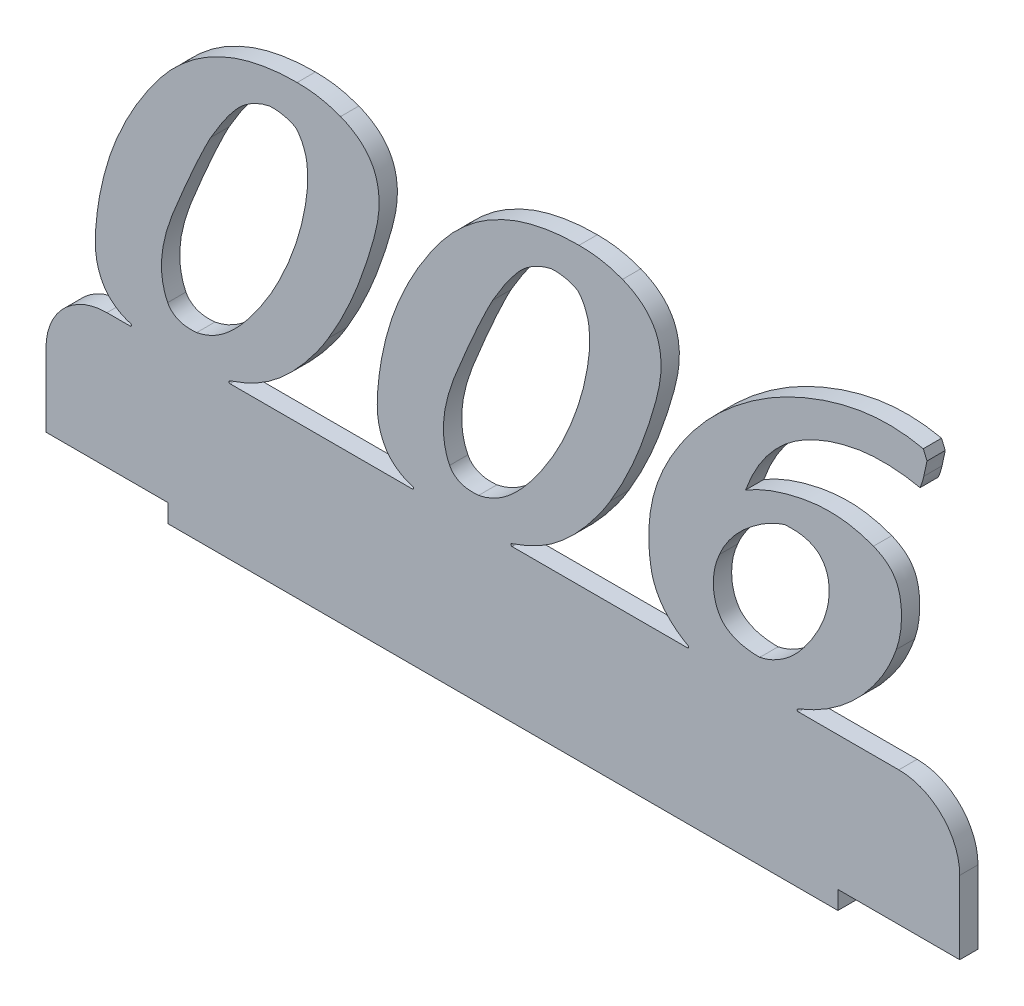
from build123d import *

# Parameters (mm, degrees)
BOSS_EXTRUDE1_DEPTH = 3
FILLET1_R           = 10
FILLET2_R           = 0.2


with BuildPart() as part:
    # Sketch1 → Boss-Extrude1 (new body)
    with BuildSketch(Plane.XY):
        with BuildLine():
            Line((122.4075168, 22.000000006), (150, 22.000001605))
            Line((150, 22.000001605), (150, 0))
            Line((150, 0), (130, 0))
            Line((130, 0), (130, -3))
            Line((130, -3), (20, -3))
            Line((20, -3), (20, 0))
            Line((20, 0), (0, 0))
            Line((0, 0), (0, 21.999999988))
            Line((0, 21.999999988), (15.311365218, 21.999999988))
            add(Edge.make_bspline(
                [(15.311365218, 21.999999988), (14.849794417, 22.113433586), (13.865602704, 22.384922298), (12.415535541, 22.895658378), (11.109150194, 23.745516599), (9.999187198, 24.764577141), (9.169313791, 26.041847988), (8.563831538, 27.513378189), (8.010207131, 29.878220371), (8.079839361, 31.797926946), (8.170181628, 33.112460211)],
                knots=[0.4482427, 0.4482427, 0.4482427, 0.4482427, 0.501387928, 0.562299825, 0.61931963, 0.674487907, 0.729675441, 0.788153341, 0.851799168, 1, 1, 1, 1], degree=3))
            add(Edge.make_bspline(
                [(8.170181628, 33.112460211), (8.337105694, 35.340556619), (8.826298564, 38.666130245), (9.955685037, 43.002934363), (11.018517432, 46.212297745), (12.373140875, 49.345635262), (13.911139099, 52.451464487), (15.718875628, 55.494613428), (17.725960704, 58.461747451), (19.923499141, 61.251096147), (22.397753947, 63.669909948), (25.04001838, 65.757541635), (27.920238635, 67.404932429), (30.955738631, 68.752774119), (35.378146308, 69.975102855), (38.856865163, 70.359817134), (41.223348165, 70.329035661)],
                knots=[0, 0, 0, 0, 0.122246067, 0.183381441, 0.245050885, 0.307031795, 0.37001055, 0.434578783, 0.500534692, 0.565957523, 0.628479512, 0.689453544, 0.749684058, 0.80955899, 0.870724503, 1, 1, 1, 1], degree=3))
            add(Edge.make_bspline(
                [(41.223348165, 70.329035661), (42.48358762, 70.318585807), (44.926426901, 70.175069876), (47.266580825, 69.465214081), (48.357828227, 69.058511814)],
                knots=[0, 0, 0, 0, 0.519885394, 1, 1, 1, 1], degree=3))
            add(Edge.make_bspline(
                [(48.357828227, 69.058511814), (49.625375641, 68.543213602), (51.420428299, 67.54986363), (53.159740965, 65.566951611), (54.069263058, 63.893477491), (54.584545639, 61.988558677), (54.749856614, 59.871513315), (54.556749177, 57.540744771), (53.807348911, 54.201337228), (52.528828565, 50.034909143), (50.227644954, 43.731329629), (48.030728771, 39.305052238), (46.364083114, 36.552647858)],
                knots=[0, 0, 0, 0, 0.111905612, 0.162582178, 0.212592743, 0.265416324, 0.321765959, 0.384451445, 0.45478123, 0.599580751, 0.738515281, 1, 1, 1, 1], degree=3))
            add(Edge.make_bspline(
                [(46.364083114, 36.552647858), (45.272598995, 34.695435575), (43.402301562, 32.124961088), (40.652950183, 29.001977978), (38.484255286, 26.932710145), (36.101823608, 25.125047689), (33.422099812, 23.629253577), (30.988119124, 22.639819784), (29.448304613, 22.152860605), (28.920236873, 21.999999988)],
                knots=[0, 0, 0, 0, 0.257859597, 0.380113614, 0.498337489, 0.61657684, 0.737567111, 0.865047578, 0.930898872, 0.930898872, 0.930898872, 0.930898872], degree=3))
            Line((28.920236873, 21.999999988), (61.5975263, 21.999999988))
            add(Edge.make_bspline(
                [(61.5975263, 21.999999988), (61.135955493, 22.113433587), (60.151763773, 22.384922294), (58.701696604, 22.895658379), (57.395311257, 23.745516598), (56.285348261, 24.764577141), (55.455474854, 26.041847988), (54.849992601, 27.513378189), (54.296368194, 29.878220371), (54.366000425, 31.797926946), (54.456342692, 33.112460211)],
                knots=[0.4482427, 0.4482427, 0.4482427, 0.4482427, 0.501387928, 0.562299825, 0.61931963, 0.674487907, 0.729675441, 0.788153341, 0.851799168, 1, 1, 1, 1], degree=3))
            add(Edge.make_bspline(
                [(54.456342692, 33.112460211), (54.623266758, 35.340556619), (55.112459628, 38.666130245), (56.241846101, 43.002934363), (57.304678495, 46.212297745), (58.659301938, 49.345635262), (60.197300163, 52.451464487), (62.005036692, 55.494613428), (64.012121768, 58.461747451), (66.209660204, 61.251096147), (68.68391501, 63.669909948), (71.326179444, 65.757541635), (74.206399698, 67.404932429), (77.241899694, 68.752774119), (81.664307371, 69.975102855), (85.143026227, 70.359817134), (87.509509228, 70.329035661)],
                knots=[0, 0, 0, 0, 0.122246067, 0.183381441, 0.245050885, 0.307031795, 0.37001055, 0.434578783, 0.500534692, 0.565957523, 0.628479512, 0.689453544, 0.749684058, 0.80955899, 0.870724503, 1, 1, 1, 1], degree=3))
            add(Edge.make_bspline(
                [(87.509509228, 70.329035661), (88.769748683, 70.318585807), (91.212587965, 70.175069876), (93.552741888, 69.465214081), (94.643989291, 69.058511814)],
                knots=[0, 0, 0, 0, 0.519885394, 1, 1, 1, 1], degree=3))
            add(Edge.make_bspline(
                [(94.643989291, 69.058511814), (95.911536704, 68.543213602), (97.706589362, 67.54986363), (99.445902028, 65.566951611), (100.355424121, 63.893477491), (100.870706703, 61.988558677), (101.036017677, 59.871513315), (100.84291024, 57.540744771), (100.093509974, 54.201337228), (98.814989628, 50.034909143), (96.513806017, 43.731329629), (94.316889835, 39.305052238), (92.650244177, 36.552647858)],
                knots=[0, 0, 0, 0, 0.111905612, 0.162582178, 0.212592743, 0.265416324, 0.321765959, 0.384451445, 0.45478123, 0.599580751, 0.738515281, 1, 1, 1, 1], degree=3))
            add(Edge.make_bspline(
                [(92.650244177, 36.552647858), (91.558760059, 34.695435575), (89.688462626, 32.124961088), (86.939111246, 29.001977978), (84.770416349, 26.932710145), (82.387984672, 25.125047689), (79.708260875, 23.629253577), (77.274280188, 22.639819784), (75.734465676, 22.152860605), (75.206397937, 21.999999988)],
                knots=[0, 0, 0, 0, 0.257859597, 0.380113614, 0.498337489, 0.61657684, 0.737567111, 0.865047578, 0.930898872, 0.930898872, 0.930898872, 0.930898872], degree=3))
            Line((75.206397937, 21.999999988), (106.28796527, 21.999999988))
            add(Edge.make_bspline(
                [(106.28796527, 21.999999988), (105.786880277, 22.19585133), (105.296843083, 22.420513378)],
                knots=[0.965898356, 0.965898356, 0.965898356, 1, 1, 1], degree=2))
            add(Edge.make_bspline(
                [(105.296843083, 22.420513378), (104.486166131, 22.888030627), (103.338694652, 23.654820139), (102.041568869, 24.90188967), (101.212849656, 25.87828732), (100.5278295, 26.938436026), (99.786310234, 28.458940585), (99.411230186, 29.6813211), (99.296061222, 30.532319476)],
                knots=[0, 0, 0, 0, 0.268967194, 0.393275026, 0.515369484, 0.635690079, 0.754431288, 1, 1, 1, 1], degree=3))
            add(Edge.make_bspline(
                [(99.296061222, 30.532319476), (99.082546931, 31.895995473), (98.88881604, 33.959538025), (98.990167098, 36.703687367), (99.255551392, 38.734318011), (99.655605154, 40.744932999), (100.25376052, 42.736787761), (101.018450422, 44.707214157), (102.245607183, 47.311715558), (104.104429697, 50.423701588), (106.666521431, 53.934742265), (109.581609963, 57.189108947), (112.839063986, 60.135349988), (116.354428952, 62.797129096), (120.086732272, 65.110880013), (124.028701712, 67.030711107), (128.091867327, 68.587633152), (132.205043553, 69.716048091), (137.532374847, 70.484694246), (141.501778564, 70.218773967), (144.018500627, 69.664453957)],
                knots=[0, 0, 0, 0, 0.061189452, 0.091529958, 0.121506925, 0.151859794, 0.182282627, 0.213544822, 0.245449815, 0.309778381, 0.373827032, 0.437828151, 0.503032098, 0.568174, 0.633000924, 0.697310694, 0.76219868, 0.825587197, 0.885941693, 1, 1, 1, 1], degree=3))
            Line((144.018500627, 69.664453957), (144.62444277, 68.218011423))
            add(Edge.make_bspline(
                [(144.62444277, 68.218011423), (144.487361406, 67.620060594), (144.310527657, 66.805793124), (144.145731426, 65.988968743), (144.09668671, 65.774696333)],
                knots=[0, 0, 0, 0, 0.7362097, 1, 1, 1, 1], degree=3))
            add(Edge.make_bspline(
                [(144.09668671, 65.774696333), (143.879808098, 64.789221674), (143.490744568, 63.859137303)],
                knots=[0, 0, 0, 1, 1, 1], degree=2))
            add(Edge.make_bspline(
                [(143.490744568, 63.859137303), (142.043281137, 64.169548106), (139.852554067, 64.484684109), (136.928408372, 64.526769676), (134.769597176, 64.423016937), (132.632103632, 64.102103572), (130.51860818, 63.605875866), (128.41317666, 62.968499684), (126.364914797, 62.12687234), (124.386713909, 61.148263618), (122.558434625, 59.95944201), (120.867654251, 58.618238511), (119.355658163, 57.06913884), (117.978767171, 55.366387568), (116.337665476, 52.804919119), (115.368529866, 50.697808785), (114.855091714, 49.218793284)],
                knots=[0, 0, 0, 0, 0.125882979, 0.187368141, 0.248380053, 0.309394479, 0.370789779, 0.432803956, 0.49615645, 0.558820111, 0.62011541, 0.681180087, 0.74188203, 0.803725331, 0.867017276, 1, 1, 1, 1], degree=3))
            add(Edge.make_bspline(
                [(114.855091714, 49.218793284), (116.389364344, 50.105401747), (118.84724178, 51.231034614), (122.33313746, 52.24868546), (125.07433434, 52.826988219), (127.853439785, 53.106585168), (131.511719498, 53.01459759), (134.167930065, 52.363338608), (135.848054967, 51.720747936)],
                knots=[0, 0, 0, 0, 0.243538844, 0.369640561, 0.498563512, 0.628138079, 0.752678105, 1, 1, 1, 1], degree=3))
            add(Edge.make_bspline(
                [(135.848054967, 51.720747936), (136.999258714, 51.247995875), (138.67226962, 50.234516125), (139.909002893, 48.043663454), (140.337886087, 46.232857283), (140.479005556, 44.353608336), (140.367650165, 41.87639133), (140.012013819, 40.064965405), (139.600986945, 38.917776865)],
                knots=[0, 0, 0, 0, 0.255610183, 0.374244794, 0.499504671, 0.629042342, 0.754309146, 1, 1, 1, 1], degree=3))
            add(Edge.make_bspline(
                [(139.600986945, 38.917776865), (138.998905233, 37.228326217), (137.465784686, 33.893843756), (135.211971339, 30.999320494), (133.991135498, 29.613633003)],
                knots=[0, 0, 0, 0, 0.492481179, 1, 1, 1, 1], degree=3))
            add(Edge.make_bspline(
                [(133.991135498, 29.613633003), (132.236455809, 27.713601477), (129.220975707, 25.173422722), (125.064844551, 23.025535923), (123.132057115, 22.255755545), (122.4075168, 22.000000006)],
                knots=[0, 0, 0, 0, 0.246096011, 0.370527708, 0.443537824, 0.443537824, 0.443537824, 0.443537824], degree=3))
        make_face()
        with BuildLine():
            add(Edge.make_bspline(
                [(41.08652252, 63.722311658), (40.485262553, 64.131828808), (39.019974247, 64.637973003), (37.482178207, 64.765268139), (36.669008837, 64.719184215)],
                knots=[0, 0, 0, 0, 0.469698931, 1, 1, 1, 1], degree=3))
            add(Edge.make_bspline(
                [(36.669008837, 64.719184215), (35.524307565, 64.478495712), (33.906268657, 63.800967407), (32.017881713, 62.423401658), (29.709975036, 59.845341383), (28.176277272, 57.393757335), (27.032574122, 55.415040352)],
                knots=[0, 0, 0, 0, 0.252589616, 0.375811021, 0.503770371, 1, 1, 1, 1], degree=3))
            add(Edge.make_bspline(
                [(27.032574122, 55.415040352), (26.576295307, 54.616984598), (25.978075493, 53.300418972), (25.086562331, 51.481356613), (24.37309467, 49.899808663), (23.608713146, 48.180580179), (22.808225843, 46.313851335), (21.951627044, 44.317643234), (21.079563026, 42.229321525), (20.286574534, 40.131145531), (19.654918827, 38.103792345), (19.214113287, 36.19669864), (18.971211802, 34.403654797), (18.923897973, 32.724370267), (19.125602145, 30.69867106), (19.545110151, 29.275013709), (19.976280143, 28.421295239)],
                knots=[0, 0, 0, 0, 0.095871325, 0.150956838, 0.211549603, 0.277044413, 0.347448488, 0.423659813, 0.503898773, 0.583776288, 0.6578152, 0.725493304, 0.78794858, 0.846481479, 0.900510454, 1, 1, 1, 1], degree=3))
            add(Edge.make_bspline(
                [(19.976280143, 28.421295239), (20.334726984, 27.678278221), (21.83420104, 26.471002739), (23.747102087, 26.454414487), (24.726084678, 26.525282729)],
                knots=[0, 0, 0, 0, 0.446153942, 1, 1, 1, 1], degree=3))
            add(Edge.make_bspline(
                [(24.726084678, 26.525282729), (26.183609176, 26.799637937), (28.340204444, 27.818058503), (30.872505961, 29.985828035), (32.822967911, 32.143020613), (34.68976695, 34.628539784), (36.451292716, 37.302541581), (38.041740853, 40.129028179), (39.436268772, 43.085276179), (40.63441894, 46.102260639), (41.62595392, 49.114322488), (42.344635809, 52.102819342), (42.849173017, 54.99342269), (43.018789837, 57.695177946), (42.816923703, 60.725741111), (41.942077091, 62.714292575), (41.08652252, 63.722311658)],
                knots=[0, 0, 0, 0, 0.099522769, 0.157975555, 0.224341199, 0.295661745, 0.367825167, 0.440561069, 0.514605516, 0.588508481, 0.659789613, 0.728660389, 0.796041852, 0.857776262, 0.9112652, 1, 1, 1, 1], degree=3))
        make_face(mode=Mode.SUBTRACT)
        with BuildLine():
            add(Edge.make_bspline(
                [(87.372683583, 63.722311658), (86.771423617, 64.131828808), (85.306135311, 64.637973003), (83.768339271, 64.765268139), (82.9551699, 64.719184215)],
                knots=[0, 0, 0, 0, 0.469698931, 1, 1, 1, 1], degree=3))
            add(Edge.make_bspline(
                [(82.9551699, 64.719184215), (81.810468628, 64.478495712), (80.192429721, 63.800967407), (78.304042777, 62.423401658), (75.996136099, 59.845341383), (74.462438335, 57.393757335), (73.318735186, 55.415040352)],
                knots=[0, 0, 0, 0, 0.252589616, 0.375811021, 0.503770371, 1, 1, 1, 1], degree=3))
            add(Edge.make_bspline(
                [(73.318735186, 55.415040352), (72.86245637, 54.616984598), (72.264236556, 53.300418972), (71.372723395, 51.481356613), (70.659255733, 49.899808663), (69.89487421, 48.180580179), (69.094386906, 46.313851335), (68.237788107, 44.317643234), (67.36572409, 42.229321525), (66.572735598, 40.131145531), (65.94107989, 38.103792345), (65.50027435, 36.19669864), (65.257372865, 34.403654797), (65.210059037, 32.724370267), (65.411763208, 30.69867106), (65.831271214, 29.275013709), (66.262441206, 28.421295239)],
                knots=[0, 0, 0, 0, 0.095871325, 0.150956838, 0.211549603, 0.277044413, 0.347448488, 0.423659813, 0.503898773, 0.583776288, 0.6578152, 0.725493304, 0.78794858, 0.846481479, 0.900510454, 1, 1, 1, 1], degree=3))
            add(Edge.make_bspline(
                [(66.262441206, 28.421295239), (66.620888047, 27.678278221), (68.120362103, 26.471002739), (70.03326315, 26.454414487), (71.012245741, 26.525282729)],
                knots=[0, 0, 0, 0, 0.446153942, 1, 1, 1, 1], degree=3))
            add(Edge.make_bspline(
                [(71.012245741, 26.525282729), (72.469770239, 26.799637937), (74.626365507, 27.818058503), (77.158667024, 29.985828035), (79.109128974, 32.143020613), (80.975928013, 34.628539784), (82.737453779, 37.302541581), (84.327901917, 40.129028179), (85.722429836, 43.085276179), (86.920580004, 46.102260639), (87.912114983, 49.114322488), (88.630796872, 52.102819342), (89.135334081, 54.99342269), (89.3049509, 57.695177946), (89.103084766, 60.725741111), (88.228238154, 62.714292575), (87.372683583, 63.722311658)],
                knots=[0, 0, 0, 0, 0.099522769, 0.157975555, 0.224341199, 0.295661745, 0.367825167, 0.440561069, 0.514605516, 0.588508481, 0.659789613, 0.728660389, 0.796041852, 0.857776262, 0.9112652, 1, 1, 1, 1], degree=3))
        make_face(mode=Mode.SUBTRACT)
        with BuildLine():
            add(Edge.make_bspline(
                [(121.26635051, 47.498699461), (120.207901571, 47.181488246), (118.651907258, 46.440880356), (116.65817074, 45.148042517), (115.123784986, 43.956833697), (113.677355787, 42.626569155), (112.031207058, 40.681997839), (111.048043858, 39.07211337), (110.574403677, 37.920904308)],
                knots=[0, 0, 0, 0, 0.224053802, 0.348681009, 0.482825361, 0.618797102, 0.747603841, 1, 1, 1, 1], degree=3))
            add(Edge.make_bspline(
                [(110.574403677, 37.920904308), (109.983317863, 36.69206739), (109.508778005, 34.724006045), (109.567899025, 32.08274343), (109.948986168, 30.522568152), (110.48571541, 29.378571836), (111.020228896, 28.609111914), (111.720500258, 27.977969358), (112.556761388, 27.47665576), (113.508202546, 27.046448387), (115.064513921, 26.695067112), (116.307425356, 26.572217406), (117.18112768, 26.583922291)],
                knots=[0, 0, 0, 0, 0.248209204, 0.363825411, 0.480559475, 0.538643133, 0.594178448, 0.650676581, 0.70952493, 0.771943031, 0.840711898, 1, 1, 1, 1], degree=3))
            add(Edge.make_bspline(
                [(117.18112768, 26.583922291), (118.682686613, 26.88443576), (120.821480463, 27.970858329), (123.299561256, 30.148870852), (124.983011021, 32.277361659), (126.471217244, 34.555642483), (127.940187359, 37.544055631), (128.510685755, 39.887647516), (128.576749259, 41.419731517)],
                knots=[0, 0, 0, 0, 0.229646533, 0.35693215, 0.497199523, 0.639277987, 0.768609413, 1, 1, 1, 1], degree=3))
            add(Edge.make_bspline(
                [(128.576749259, 41.419731517), (128.585168352, 42.376810165), (128.44713714, 43.791195008), (127.630925259, 45.378878199), (126.828307408, 46.306664506), (125.743396803, 46.952775516), (123.896240273, 47.564916809), (122.335069698, 47.559388863), (121.26635051, 47.498699461)],
                knots=[0, 0, 0, 0, 0.260934604, 0.37190919, 0.477858893, 0.587725738, 0.708482117, 1, 1, 1, 1], degree=3))
        make_face(mode=Mode.SUBTRACT)
    extrude(amount=BOSS_EXTRUDE1_DEPTH)

    # Fillet1
    fillet1_edges = [part.edges().sort_by_distance(p)[0] for p in [
        (0, 21.999999988, 1.5),
        (150, 22.000001605, 1.5),
    ]]
    fillet(fillet1_edges, radius=FILLET1_R)

    # Fillet2
    fillet2_edges = [part.edges().sort_by_distance(p)[0] for p in [
        (28.920236873, 21.999999988, 1.5),
        (75.206397937, 21.999999988, 1.5),
        (122.4075168, 22.000000006, 1.5),
        (106.28796527, 21.999999988, 1.5),
        (61.5975263, 21.999999988, 1.5),
        (15.311365218, 21.999999988, 1.5),
    ]]
    fillet(fillet2_edges, radius=FILLET2_R)


solid = part.part
